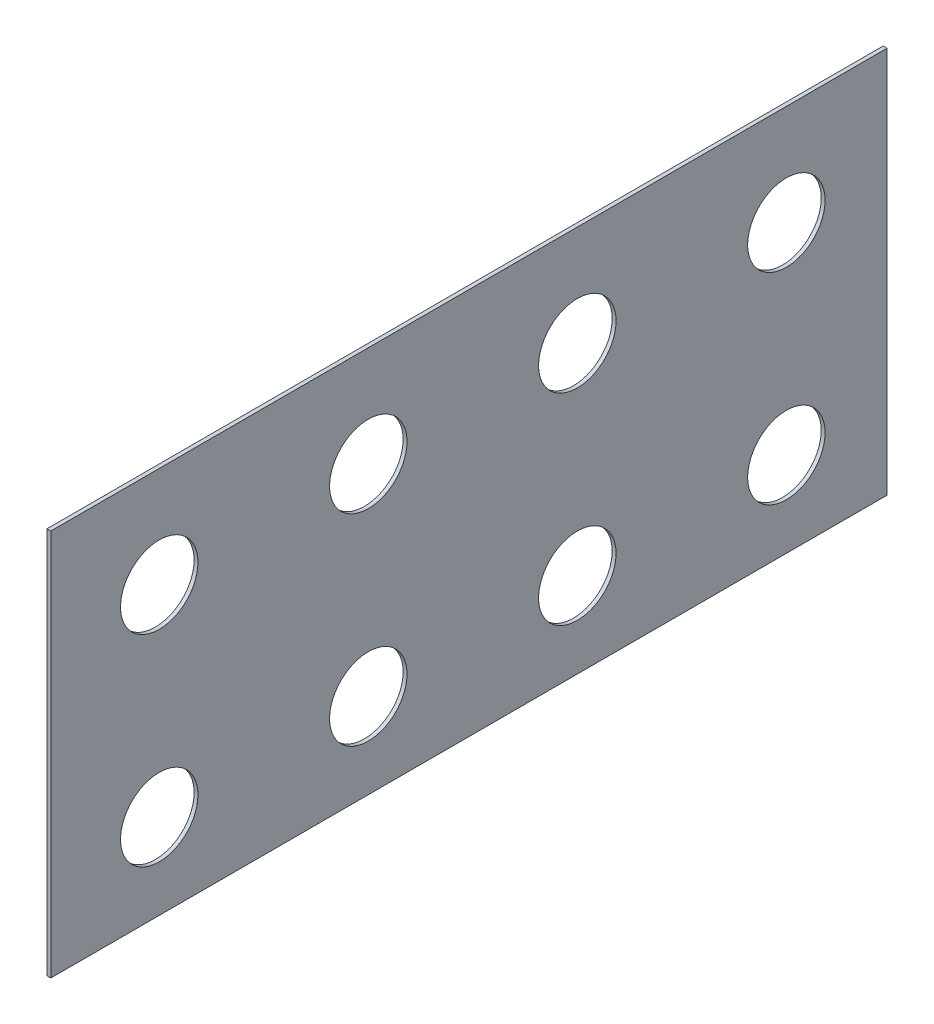
from build123d import *

# Parameters (mm, degrees)
CROQUIS1_W     = 1080
CROQUIS1_H     = 500
EXTRUIR1_DEPTH = 5
CROQUIS3_R     = 50
EXTRUIR2_DEPTH = 596.08402768


with BuildPart() as part:
    # Croquis1 → Extruir1 (new body)
    with BuildSketch(Plane(origin=(0, 0, 0), x_dir=(0, 0, -1), z_dir=(1, 0, 0))):
        Rectangle(CROQUIS1_W, CROQUIS1_H)
    extrude(amount=EXTRUIR1_DEPTH)

    # Croquis3 → Extruir2 (cut, through all)
    with BuildSketch(Plane(origin=(5, 0, 0), x_dir=(0, 0, -1), z_dir=(1, 0, 0))):
        with Locations((-400, 380)):
            Circle(CROQUIS3_R)
        with Locations((-130, 380)):
            Circle(CROQUIS3_R)
        with Locations((140, 380)):
            Circle(CROQUIS3_R)
        with Locations((410, 380)):
            Circle(CROQUIS3_R)
        with Locations((-400, 120)):
            Circle(CROQUIS3_R)
        with Locations((-130, 120)):
            Circle(CROQUIS3_R)
        with Locations((140, 120)):
            Circle(CROQUIS3_R)
        with Locations((410, 120)):
            Circle(CROQUIS3_R)
        with Locations((-400, -140)):
            Circle(CROQUIS3_R)
        with Locations((-130, -140)):
            Circle(CROQUIS3_R)
        with Locations((140, -140)):
            Circle(CROQUIS3_R)
        with Locations((410, -140)):
            Circle(CROQUIS3_R)
        with Locations((-400, -400)):
            Circle(CROQUIS3_R)
        with Locations((-130, -400)):
            Circle(CROQUIS3_R)
        with Locations((140, -400)):
            Circle(CROQUIS3_R)
        with Locations((410, -400)):
            Circle(CROQUIS3_R)
    extrude(amount=-EXTRUIR2_DEPTH, mode=Mode.SUBTRACT)


solid = part.part
